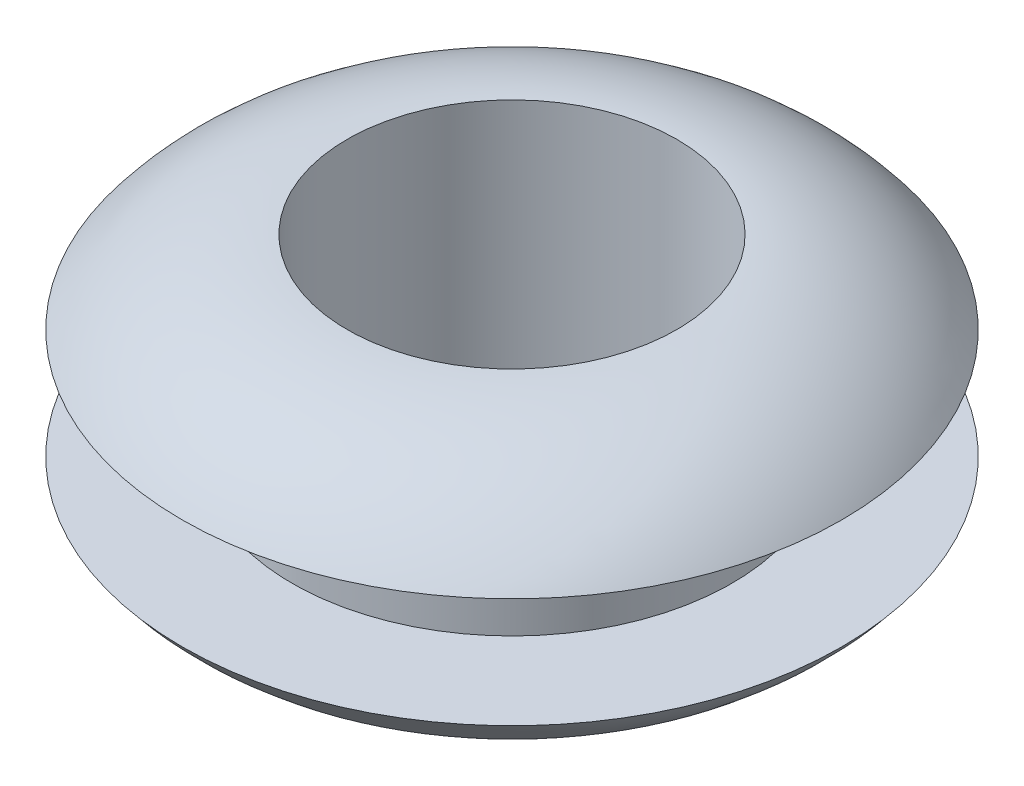
from build123d import *


with BuildPart() as part:
    # Эскиз1 → Повернуть1 (revolve)
    with BuildSketch(Plane.XY, mode=Mode.PRIVATE) as revolve_1_sk:
        with BuildLine():
            Line((-3, -2.5), (-3, 2.5))
            ThreePointArc((-3, 2.5), (-4.674981248, 2.099962496), (-6, 1))
            Line((-6, 1), (-4, 1))
            Line((-4, 1), (-4, -1))
            Line((-4, -1), (-6, -1))
            ThreePointArc((-6, -1), (-4.674981248, -2.099962496), (-3, -2.5))
        make_face()
    revolve(revolve_1_sk.sketch.rotate(Axis((0, 0, 0), (0, 1, 0)), 270), axis=Axis((0, 0, 0), (0, 1, 0)))


solid = part.part
